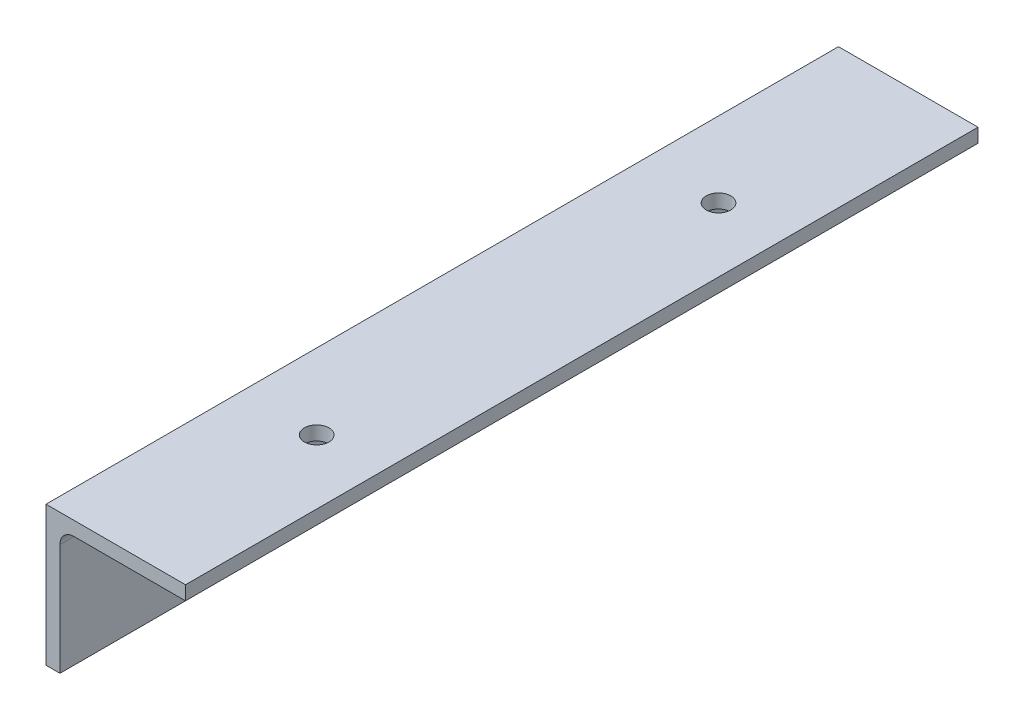
from build123d import *

# Parameters (mm, degrees)
EXTRUDE_1_DEPTH     = 142
FILLET_1_R          = 5
SKETCH_2_R          = 4.4
CUT_EXTRUDE_1_DEPTH = 10


with BuildPart() as part:
    # Эскиз1 → Бобышка-Вытянуть1 (new, symmetric)
    with BuildSketch(Plane.XY):
        Polygon((0, 0), (50, 0), (50, -5), (5, -5), (5, -50), (0, -50), align=None)
    extrude(amount=EXTRUDE_1_DEPTH, both=True)

    # Скругление1
    fillet_1_edges = [part.edges().sort_by_distance(p)[0] for p in [
        (5, -5, 0),
    ]]
    fillet(fillet_1_edges, radius=FILLET_1_R)

    # Эскиз2 → Вырез-Вытянуть1 (cut)
    with BuildSketch(Plane(origin=(0, 0, 0), x_dir=(1, 0, 0), z_dir=(0, 1, 0))):
        with Locations(Location((27, 72, 0), (0, 0, 270))):
            Circle(SKETCH_2_R)
    cut_extrude_1 = extrude(amount=-CUT_EXTRUDE_1_DEPTH, mode=Mode.SUBTRACT)

    # Зеркальное отражение1: Вырез-Вытянуть1 across plane
    add(cut_extrude_1.mirror(Plane.XY), mode=Mode.SUBTRACT)


solid = part.part
